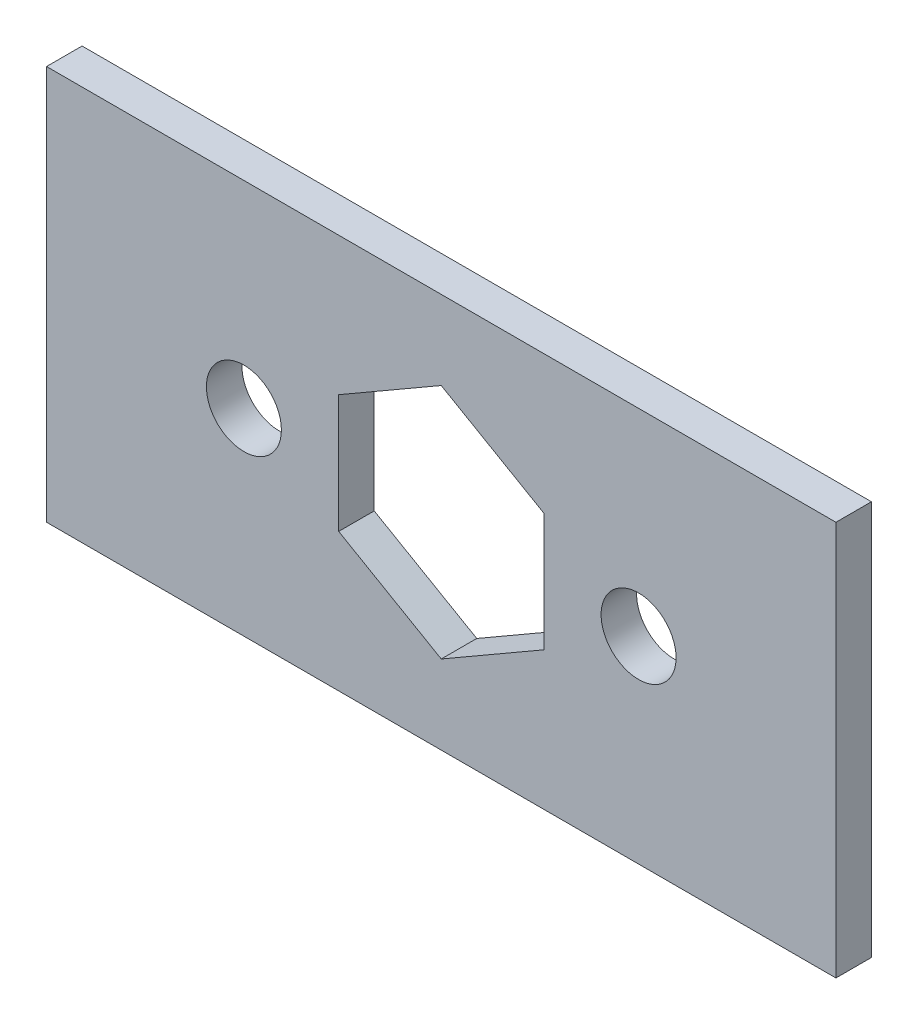
from build123d import *

# Parameters (mm, degrees)
SKETCH1_W           = 50.8
SKETCH1_H           = 25.4
SKETCH1_R           = 2.413
BOSS_EXTRUDE1_DEPTH = 1.143


with BuildPart() as part:
    # Sketch1 → Boss-Extrude1 (new, symmetric)
    with BuildSketch(Plane.XY):
        Rectangle(SKETCH1_W, SKETCH1_H)
        with Locations((-12.7, 0)):
            Circle(SKETCH1_R, mode=Mode.SUBTRACT)
        with Locations((12.7, 0)):
            Circle(SKETCH1_R, mode=Mode.SUBTRACT)
        Polygon((0, 7.62), (-6.599113577, 3.81), (-6.599113577, -3.81), (0, -7.62), (6.599113577, -3.81), (6.599113577, 3.81), align=None, mode=Mode.SUBTRACT)
    extrude(amount=BOSS_EXTRUDE1_DEPTH, both=True)


solid = part.part
